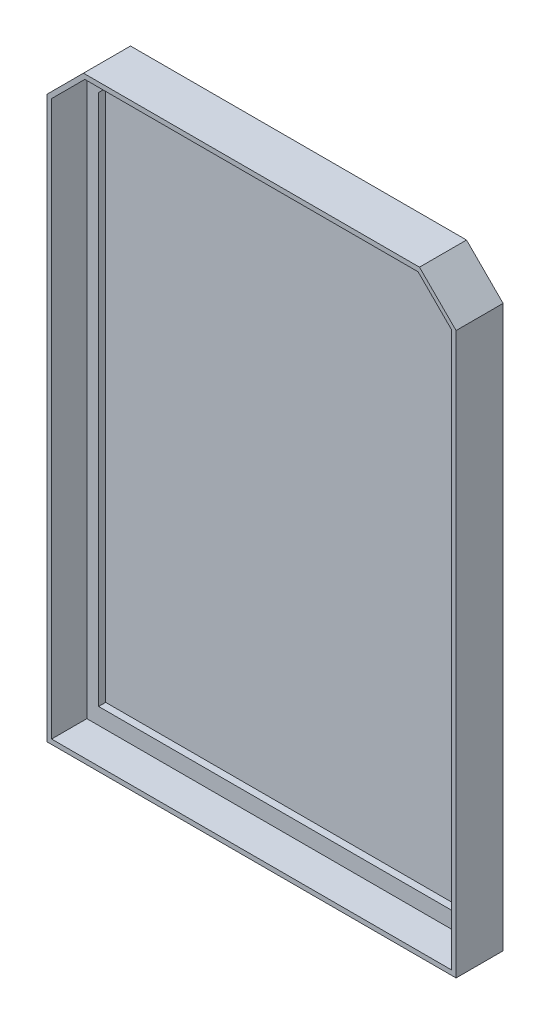
from build123d import *

# Parameters (mm, degrees)
BOSS_EXTRUDE1_DEPTH = 1.5
BOSS_EXTRUDE2_DEPTH = 9
BOSS_EXTRUDE3_DEPTH = 1
SKETCH4_R           = 5
SKETCH4_R_2         = 4
BOSS_EXTRUDE4_DEPTH = 10
FILLET1_R           = 5


with BuildPart() as part:
    # Sketch1 → Boss-Extrude1 (new body)
    with BuildSketch(Plane(origin=(0, 0, 0), x_dir=(0, 1, 0), z_dir=(0, 0, 1))):
        Polygon((-62.5, -42.5), (-62.5, 42.5), (55.428932188, 42.5), (62.5, 35.428932188), (62.5, -35.428932188), (55.428932188, -42.5), align=None)
        Polygon((54.050252532, 40), (59, 35.050252532), (59, -35.050252532), (54.050252532, -40), (-59, -40), (-59, 40), align=None, mode=Mode.SUBTRACT)
    extrude(amount=BOSS_EXTRUDE1_DEPTH)

    # Sketch2 → Boss-Extrude2 (add)
    with BuildSketch(Plane(origin=(0, 0, 0), x_dir=(0, 1, 0), z_dir=(0, 0, 1))):
        Polygon((-63.5, 43.5), (-63.5, -43.5), (55.721825407, -43.5), (63.5, -35.721825407), (63.5, 35.721825407), (55.721825407, 43.5), align=None)
        Polygon((-62.5, -42.5), (55.428932188, -42.5), (62.5, -35.428932188), (62.5, 35.428932188), (55.428932188, 42.5), (-62.5, 42.5), align=None, mode=Mode.SUBTRACT)
    extrude(amount=BOSS_EXTRUDE2_DEPTH)

    # Sketch3 → Boss-Extrude3 (add)
    with BuildSketch(Plane(origin=(0, 0, 0), x_dir=(0, 1, 0), z_dir=(0, 0, 1))):
        Polygon((63.5, 35.721825407), (55.721825407, 43.5), (-63.5, 43.5), (-63.5, -43.5), (55.721825407, -43.5), (63.5, -35.721825407), align=None)
    extrude(amount=-BOSS_EXTRUDE3_DEPTH)

    # Sketch4 → Boss-Extrude4 (add)
    with BuildSketch(Plane(origin=(0, 0, -1), x_dir=(1, 0, 0), z_dir=(0, 0, -1))):
        Circle(SKETCH4_R)
        with Locations(Location((0, 0, 0), (0, 0, 180))):
            Circle(SKETCH4_R_2, mode=Mode.SUBTRACT)
    extrude(amount=BOSS_EXTRUDE4_DEPTH)

    # Fillet1
    fillet1_edges = [part.edges().sort_by_distance(p)[0] for p in [
        (-5, 0, -1),
    ]]
    fillet(fillet1_edges, radius=FILLET1_R)


solid = part.part
